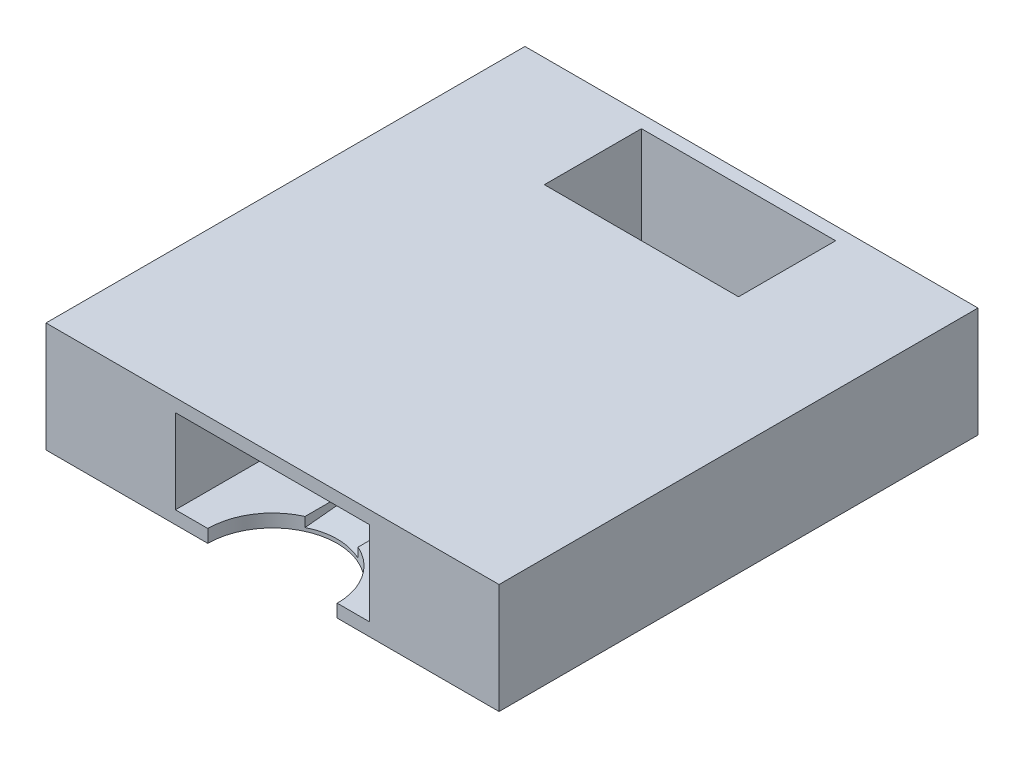
from build123d import *

# Parameters (mm, degrees)
CROQUIS1_W              = 70
CROQUIS1_H              = 100
SALIENTE_EXTRUIR1_DEPTH = 15
CROQUIS2_W              = 30
CROQUIS2_H              = 13
CORTAR_EXTRUIR1_DEPTH   = 72
CORTAR_EXTRUIR2_DEPTH   = 72
CROQUIS4_W              = 9
CROQUIS4_H              = 1.6
CORTAR_EXTRUIR3_DEPTH   = 2
CROQUIS6_W              = 8.2
CROQUIS6_H              = 2
CORTAR_EXTRUIR4_DEPTH   = 94.926889384
CORTAR_EXTRUIR5_DEPTH   = 8.2
CROQUIS8_W              = 70
CROQUIS8_H              = 57
SALIENTE_EXTRUIR3_DEPTH = 2
CROQUIS9_W              = 20
CROQUIS9_H              = 15
SALIENTE_EXTRUIR4_DEPTH = 2
CROQUIS10_W             = 70
CROQUIS10_H             = 22.450330877
SALIENTE_EXTRUIR5_DEPTH = 2
CROQUIS12_W             = 70
CROQUIS12_H             = 26
CORTAR_EXTRUIR6_DEPTH   = 64.356136246


with BuildPart() as part:
    # Croquis1 → Saliente-Extruir1 (new body)
    with BuildSketch(Plane(origin=(0, 0, 0), x_dir=(1, 0, 0), z_dir=(0, 1, 0))):
        Rectangle(CROQUIS1_W, CROQUIS1_H)
    extrude(amount=SALIENTE_EXTRUIR1_DEPTH)

    # Croquis2 → Cortar-Extruir1 (cut)
    with BuildSketch(Plane.XY.offset(50)):
        with Locations((0, 8.5)):
            Rectangle(CROQUIS2_W, CROQUIS2_H)
    extrude(amount=-CORTAR_EXTRUIR1_DEPTH, mode=Mode.SUBTRACT)

    # Croquis3 → Cortar-Extruir2 (cut)
    with BuildSketch(Plane.XZ):
        with BuildLine():
            Line((-10, 50), (10, 50))
            ThreePointArc((10, 50), (0, 40), (-10, 50))
        make_face()
    extrude(amount=-CORTAR_EXTRUIR2_DEPTH, mode=Mode.SUBTRACT)

    # Croquis4 → Cortar-Extruir3 (cut)
    with BuildSketch(Plane(origin=(0, 2, 0), x_dir=(1, 0, 0), z_dir=(0, 1, 0))):
        with Locations((0, -35.061869007)):
            Rectangle(CROQUIS4_W, CROQUIS4_H)
    extrude(amount=-CORTAR_EXTRUIR3_DEPTH, mode=Mode.SUBTRACT)

    # Croquis6 → Cortar-Extruir4 (cut, through all)
    with BuildSketch(Plane(origin=(0, 0, 35.861869007), x_dir=(-1, 0, 0), z_dir=(0, 0, -1))):
        with Locations((0, 2)):
            Rectangle(CROQUIS6_W, CROQUIS6_H)
    extrude(amount=-CORTAR_EXTRUIR4_DEPTH, mode=Mode.SUBTRACT)

    # Croquis7 → Cortar-Extruir5 (cut)
    with BuildSketch(Plane(origin=(-4.1, 0, 0), x_dir=(0, 0, -1), z_dir=(1, 0, 0))):
        Polygon((-40.879144777, 0.510423286), (-35.861869007, 1), (-40.879144777, 1), align=None)
    extrude(amount=CORTAR_EXTRUIR5_DEPTH, mode=Mode.SUBTRACT)

    # Croquis8 → Saliente-Extruir3 (add)
    with BuildSketch(Plane(origin=(0, 15, 0), x_dir=(1, 0, 0), z_dir=(0, 1, 0))):
        with Locations((0, -21.5)):
            Rectangle(CROQUIS8_W, CROQUIS8_H)
        Polygon((15, 22), (35, 22), (35, 27.549669123), (-35, 27.549669123), (-35, 22), align=None)
    extrude(amount=SALIENTE_EXTRUIR3_DEPTH)

    # Croquis9 → Saliente-Extruir4 (add)
    with BuildSketch(Plane(origin=(0, 15, 0), x_dir=(1, 0, 0), z_dir=(0, 1, 0))):
        with Locations((-25, 14.5)):
            Rectangle(CROQUIS9_W, CROQUIS9_H)
        with Locations((25, 14.5)):
            Rectangle(CROQUIS9_W, CROQUIS9_H)
    extrude(amount=SALIENTE_EXTRUIR4_DEPTH)

    # Croquis10 → Saliente-Extruir5 (add)
    with BuildSketch(Plane(origin=(0, 15, 0), x_dir=(1, 0, 0), z_dir=(0, 1, 0))):
        with Locations((0, 38.774834562)):
            Rectangle(CROQUIS10_W, CROQUIS10_H)
    extrude(amount=SALIENTE_EXTRUIR5_DEPTH)

    # Croquis12 → Cortar-Extruir6 (cut, through all)
    with BuildSketch(Plane(origin=(0, 17, 0), x_dir=(1, 0, 0), z_dir=(0, 1, 0))):
        with Locations((0, 37)):
            Rectangle(CROQUIS12_W, CROQUIS12_H)
    extrude(amount=-CORTAR_EXTRUIR6_DEPTH, mode=Mode.SUBTRACT)


solid = part.part
